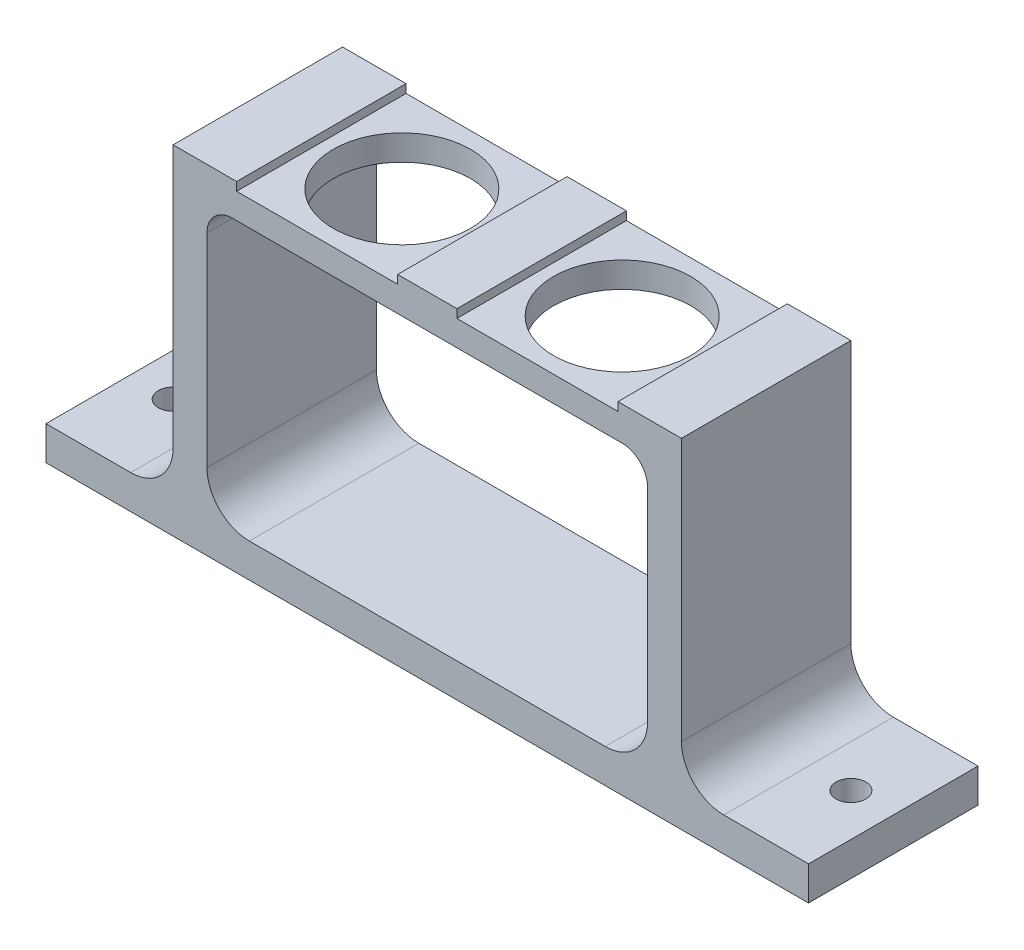
from build123d import *

# Parameters (mm, degrees)
SKETCH_1_W          = 90
SKETCH_1_H          = 20
SKETCH_1_R          = 1.75
EXTRUDE_1_DEPTH     = 4
SKETCH_2_W          = 4
SKETCH_2_H          = 20
EXTRUDE_2_DEPTH     = 32
SKETCH_3_W          = 60
SKETCH_3_H          = 20
SKETCH_3_R          = 8.1
EXTRUDE_3_DEPTH     = 4
FILLET_1_R          = 5
FILLET_2_R          = 3
SKETCH_4_W          = 19
SKETCH_4_H          = 20
CUT_EXTRUDE_1_DEPTH = 1


with BuildPart() as part:
    # 草图1 → 凸台-拉伸1 (new body)
    with BuildSketch(Plane(origin=(0, 0, 0), x_dir=(1, 0, 0), z_dir=(0, 1, 0))):
        with Locations((45, 10)):
            Rectangle(SKETCH_1_W, SKETCH_1_H)
        with Locations(Location((85, 10, 0), (0, 0, 270))):
            Circle(SKETCH_1_R, mode=Mode.SUBTRACT)
        with Locations(Location((5, 10, 0), (0, 0, 90))):
            Circle(SKETCH_1_R, mode=Mode.SUBTRACT)
    extrude(amount=EXTRUDE_1_DEPTH)

    # 草图2 → 凸台-拉伸2 (add)
    with BuildSketch(Plane(origin=(0, 4, 0), x_dir=(1, 0, 0), z_dir=(0, 1, 0))):
        with Locations((17, 10)):
            Rectangle(SKETCH_2_W, SKETCH_2_H)
        with Locations((73, 10)):
            Rectangle(SKETCH_2_W, SKETCH_2_H)
    extrude(amount=EXTRUDE_2_DEPTH)

    # 草图3 → 凸台-拉伸3 (add)
    with BuildSketch(Plane(origin=(0, 36, 0), x_dir=(1, 0, 0), z_dir=(0, 1, 0))):
        with Locations((45, 10)):
            Rectangle(SKETCH_3_W, SKETCH_3_H)
        with Locations(Location((32, 10, 0), (0, 0, 270))):
            Circle(SKETCH_3_R, mode=Mode.SUBTRACT)
        with Locations(Location((58, 10, 0), (0, 0, 270))):
            Circle(SKETCH_3_R, mode=Mode.SUBTRACT)
    extrude(amount=EXTRUDE_3_DEPTH)

    # 圆角1
    fillet_1_edges = [part.edges().sort_by_distance(p)[0] for p in [
        (15, 4, -10),
        (19, 4, -10),
        (75, 4, -10),
        (71, 4, -10),
    ]]
    fillet(fillet_1_edges, radius=FILLET_1_R)

    # 圆角2
    fillet_2_edges = [part.edges().sort_by_distance(p)[0] for p in [
        (19, 36, -10),
        (71, 36, -10),
    ]]
    fillet(fillet_2_edges, radius=FILLET_2_R)

    # 草图4 → 切除-拉伸1 (cut)
    with BuildSketch(Plane(origin=(0, 40, 0), x_dir=(1, 0, 0), z_dir=(0, 1, 0))):
        with Locations((32, 10)):
            Rectangle(SKETCH_4_W, SKETCH_4_H)
        with Locations((58, 10)):
            Rectangle(SKETCH_4_W, SKETCH_4_H)
    extrude(amount=-CUT_EXTRUDE_1_DEPTH, mode=Mode.SUBTRACT)


solid = part.part
